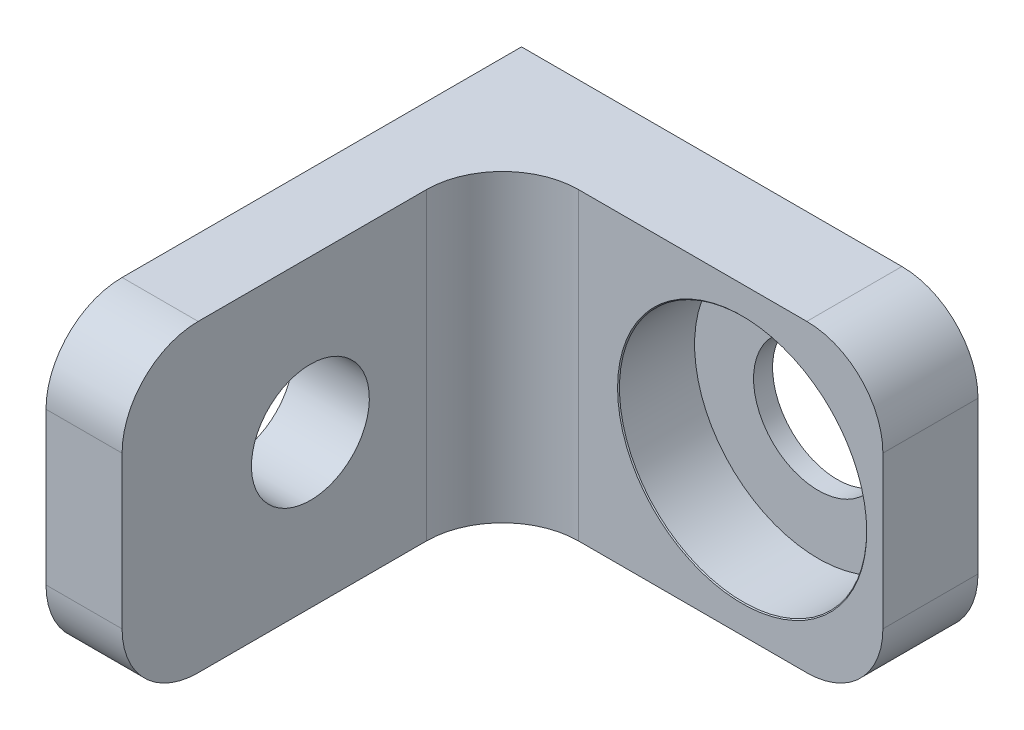
from build123d import *

# Parameters (mm, degrees)
ESBO_O1_W                = 12
ESBO_O1_H                = 8
RESSALTO_EXTRUS_O1_DEPTH = 2.5
ESBO_O3_W                = 2
ESBO_O3_H                = 8
RESSALTO_EXTRUS_O2_DEPTH = 10
FILETE1_R                = 2
FILETE2_R                = 2
CORTE_EXTRUS_O2_REACH    = 19.095
ESBO_O6_R                = 1.55


with BuildPart() as part:
    # Esboço1 → Ressalto-extrusão1 (new body)
    with BuildSketch(Plane.XY):
        with Locations((-6, 2)):
            Rectangle(ESBO_O1_W, ESBO_O1_H)
    extrude(amount=RESSALTO_EXTRUS_O1_DEPTH)

    # Esboço3 → Ressalto-extrusão2 (add)
    with BuildSketch(Plane.XY.offset(2.5)):
        with Locations((-11, 2)):
            Rectangle(ESBO_O3_W, ESBO_O3_H)
    extrude(amount=RESSALTO_EXTRUS_O2_DEPTH)

    # Esboço10 → Rebaixo para parafuso com cabeça redonda de M33 (revolve, cut)
    with BuildSketch(Plane(origin=(-3.7, 2, 2.5), x_dir=(0, -1, 0), z_dir=(1, 0, 0))):
        Polygon((0, 0), (0, 2.5), (1.7, 2.5), (1.7, 2), (3.25, 2), (3.25, 0.025), (3.275, 0), align=None)
    revolve(axis=Axis((-3.7, 2, 8.85), (0, 0, -1)), mode=Mode.SUBTRACT)

    # Filete1
    filete1_edges = [part.edges().sort_by_distance(p)[0] for p in [
        (-10, 2, 2.5),
    ]]
    fillet(filete1_edges, radius=FILETE1_R)

    # Filete2
    filete2_edges = [part.edges().sort_by_distance(p)[0] for p in [
        (-11, -2, 12.5),
        (-11, 6, 12.5),
        (0, 6, 1.25),
        (0, -2, 1.25),
    ]]
    fillet(filete2_edges, radius=FILETE2_R)

    # Esboço6 → Corte-extrusão2 (cut, up to next)
    with BuildSketch(Plane(origin=(-10, 0, 0), x_dir=(0, 0, -1), z_dir=(1, 0, 0)), mode=Mode.PRIVATE) as corte_extrus_o2_sk1:
        with Locations(Location((-7.55, 2, 0), (0, 0, 90))):
            Circle(ESBO_O6_R)
    corte_extrus_o2_tool1 = extrude(corte_extrus_o2_sk1.sketch, amount=-CORTE_EXTRUS_O2_REACH, mode=Mode.PRIVATE) & part.part
    add(corte_extrus_o2_tool1.solids().sort_by_distance((-10, 2, 7.55))[0], mode=Mode.SUBTRACT)


solid = part.part
